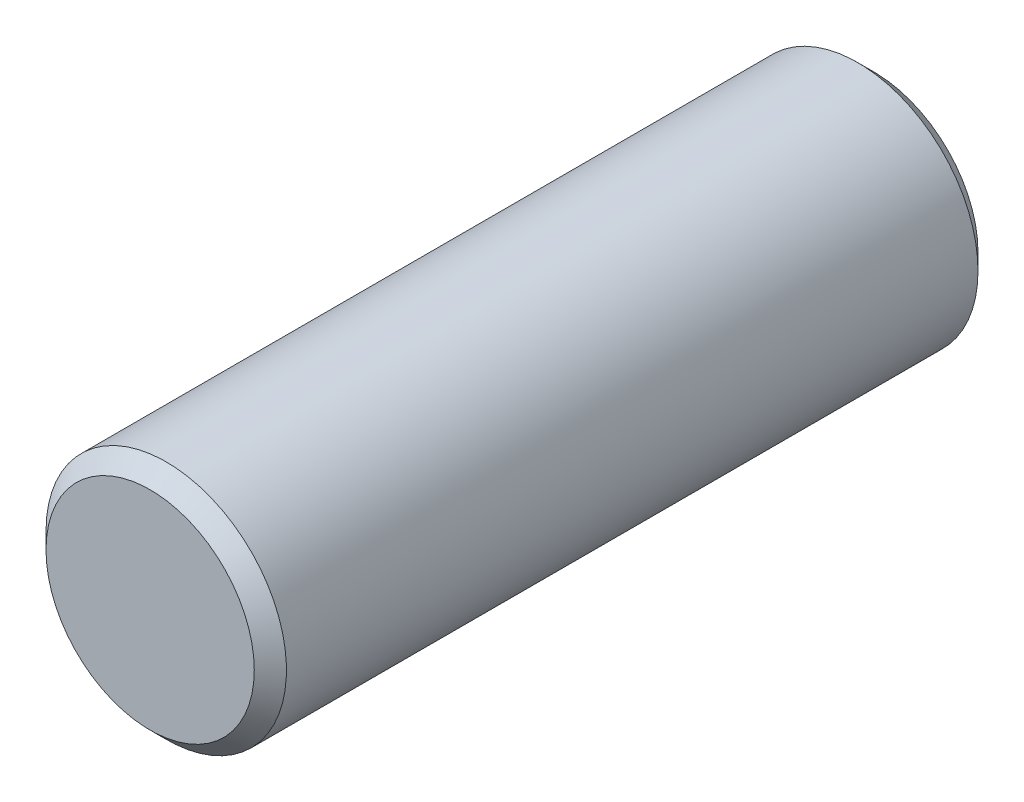
from build123d import *

# Parameters (mm, degrees)
SKETCH_1_R      = 7.475
EXTRUDE_1_DEPTH = 45
CHAMFER_1_SIZE  = 1


with BuildPart() as part:
    # 스케치1 → 보스-돌출1 (new body)
    with BuildSketch(Plane.XY):
        with Locations(Location((0, 0, 0), (0, 0, 180))):
            Circle(SKETCH_1_R)
    extrude(amount=EXTRUDE_1_DEPTH)

    # 모따기1
    chamfer_1_edges = [part.edges().sort_by_distance(p)[0] for p in [
        (7.475, 0, 0),
        (7.475, 0, 45),
    ]]
    chamfer(chamfer_1_edges, length=CHAMFER_1_SIZE)


solid = part.part
